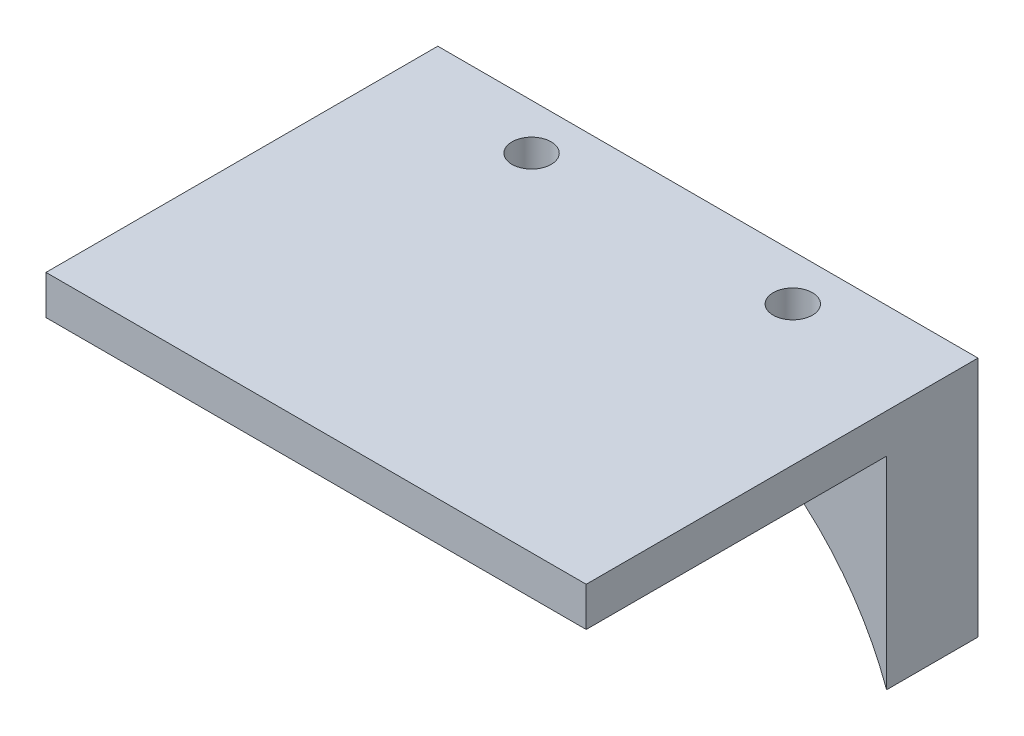
from build123d import *

# Parameters (mm, degrees)
SKETCH1_R           = 22
BOSS_EXTRUDE1_DEPTH = 7
SKETCH2_W           = 41.36423576
SKETCH2_H           = 15
BOSS_EXTRUDE2_DEPTH = 23
BOSS_EXTRUDE3_DEPTH = 7
SKETCH4_W           = 41.36423576
SKETCH4_H           = 23
BOSS_EXTRUDE4_DEPTH = 3
SKETCH5_R           = 1.5
CUT_EXTRUDE1_DEPTH  = 61.728905803
SKETCH6_R           = 22
CUT_EXTRUDE2_DEPTH  = 46.387222977


with BuildPart() as part:
    # Sketch1 → Boss-Extrude1 (new body)
    with BuildSketch(Plane.XY):
        Circle(SKETCH1_R)
    extrude(amount=BOSS_EXTRUDE1_DEPTH)

    # Sketch2 → Boss-Extrude2 (add)
    with BuildSketch(Plane.XY.offset(7)):
        Rectangle(SKETCH2_W, SKETCH2_H)
    extrude(amount=BOSS_EXTRUDE2_DEPTH)


with BuildPart() as body_2:
    # Sketch3 → Boss-Extrude3 (new body)
    with BuildSketch(Plane(origin=(0, 0, 0), x_dir=(-1, 0, 0), z_dir=(0, 0, -1))):
        with BuildLine():
            Line((-20.68211788, 7.5), (-20.68211788, 26))
            Line((-20.68211788, 26), (20.68211788, 26))
            Line((20.68211788, 26), (20.68211788, 7.5))
            ThreePointArc((20.68211788, 7.5), (0, 22), (-20.68211788, 7.5))
        make_face()
    extrude(amount=-BOSS_EXTRUDE3_DEPTH)

    # Sketch4 → Boss-Extrude4 (add)
    with BuildSketch(Plane(origin=(0, 26, 0), x_dir=(1, 0, 0), z_dir=(0, 1, 0))):
        with Locations((0, -18.5)):
            Rectangle(SKETCH4_W, SKETCH4_H)
    extrude(amount=-BOSS_EXTRUDE4_DEPTH)


with BuildPart() as cut_extrude1_tool:
    # Sketch5 → Cut-Extrude1 (new, through all)
    with BuildSketch(Plane(origin=(0, 26, 0), x_dir=(1, 0, 0), z_dir=(0, 1, 0))):
        with Locations(Location((-10, -3.5, 0), (0, 0, 270))):
            Circle(SKETCH5_R)
        with Locations(Location((10, -3.5, 0), (0, 0, 270))):
            Circle(SKETCH5_R)
    extrude(amount=-CUT_EXTRUDE1_DEPTH)


with BuildPart() as part_1:
    add(part.part)

    # Cut-Extrude1: cut by cut_extrude1_tool
    add(cut_extrude1_tool.part, mode=Mode.SUBTRACT)

    # Sketch6 → Cut-Extrude2 (cut, through all)
    with BuildSketch(Plane(origin=(0, 0, 0), x_dir=(-1, 0, 0), z_dir=(0, 0, -1))):
        Circle(SKETCH6_R)
    extrude(amount=-CUT_EXTRUDE2_DEPTH, mode=Mode.SUBTRACT)


with BuildPart() as body_2_1:
    add(body_2.part)

    # Cut-Extrude1: cut by cut_extrude1_tool
    add(cut_extrude1_tool.part, mode=Mode.SUBTRACT)


solid = body_2_1.part
